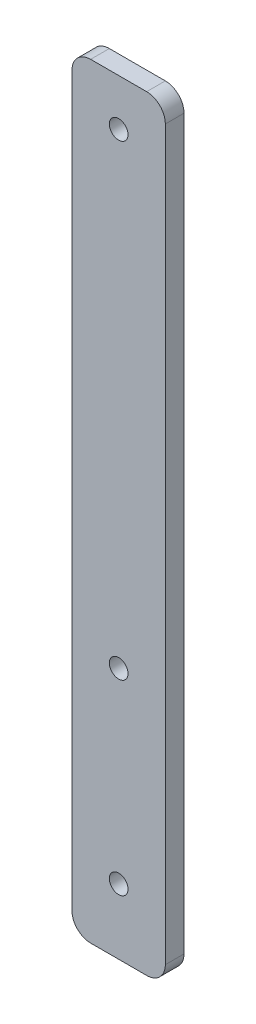
from build123d import *

# Parameters (mm, degrees)
SKETCH1_W           = 50
SKETCH1_H           = 410
SKETCH1_R           = 5
BOSS_EXTRUDE1_DEPTH = 10
FILLET1_R           = 10
SKETCH2_R           = 5
CUT_EXTRUDE1_DEPTH  = 10


with BuildPart() as part:
    # Sketch1 → Boss-Extrude1 (new body)
    with BuildSketch(Plane.XY):
        with Locations((25, -205)):
            Rectangle(SKETCH1_W, SKETCH1_H)
        with Locations((25, -275)):
            Circle(SKETCH1_R, mode=Mode.SUBTRACT)
        with Locations((25, -25)):
            Circle(SKETCH1_R, mode=Mode.SUBTRACT)
    extrude(amount=BOSS_EXTRUDE1_DEPTH)

    # Fillet1
    fillet1_edges = [part.edges().sort_by_distance(p)[0] for p in [
        (0, 0, 5),
        (50, 0, 5),
        (50, -410, 5),
        (0, -410, 5),
    ]]
    fillet(fillet1_edges, radius=FILLET1_R)

    # Sketch2 → Cut-Extrude1 (cut)
    with BuildSketch(Plane.XY.offset(10)):
        with Locations((25, -375)):
            Circle(SKETCH2_R)
    extrude(amount=-CUT_EXTRUDE1_DEPTH, mode=Mode.SUBTRACT)


solid = part.part
